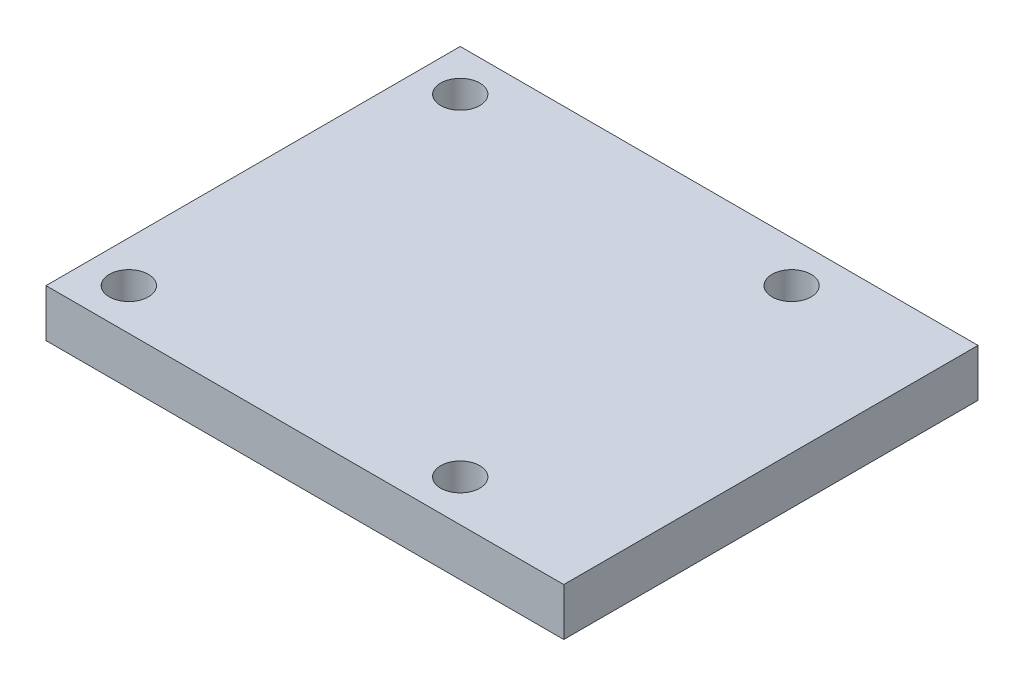
from build123d import *

# Parameters (mm, degrees)
SKETCH1_W            = 31.75
SKETCH1_H            = 25.4
BOSS_EXTRUDE1_DEPTH  = 2.921
M2_CLEARANCE_HOLE1_D = 2.4


with BuildPart() as part:
    # Sketch1 → Boss-Extrude1 (new body)
    with BuildSketch(Plane(origin=(0, 0, 0), x_dir=(1, 0, 0), z_dir=(0, 1, 0))):
        Rectangle(SKETCH1_W, SKETCH1_H)
    extrude(amount=BOSS_EXTRUDE1_DEPTH)

    # M2 Clearance Hole1 (through all)
    with Locations(Plane(origin=(0, 2.921, 0), x_dir=(1, 0, 0), z_dir=(0, 1, 0))):
        with Locations((-13.335, 10.16), (6.985, 10.16), (6.985, -10.16), (-13.335, -10.16)):
            Hole(M2_CLEARANCE_HOLE1_D / 2)


solid = part.part
